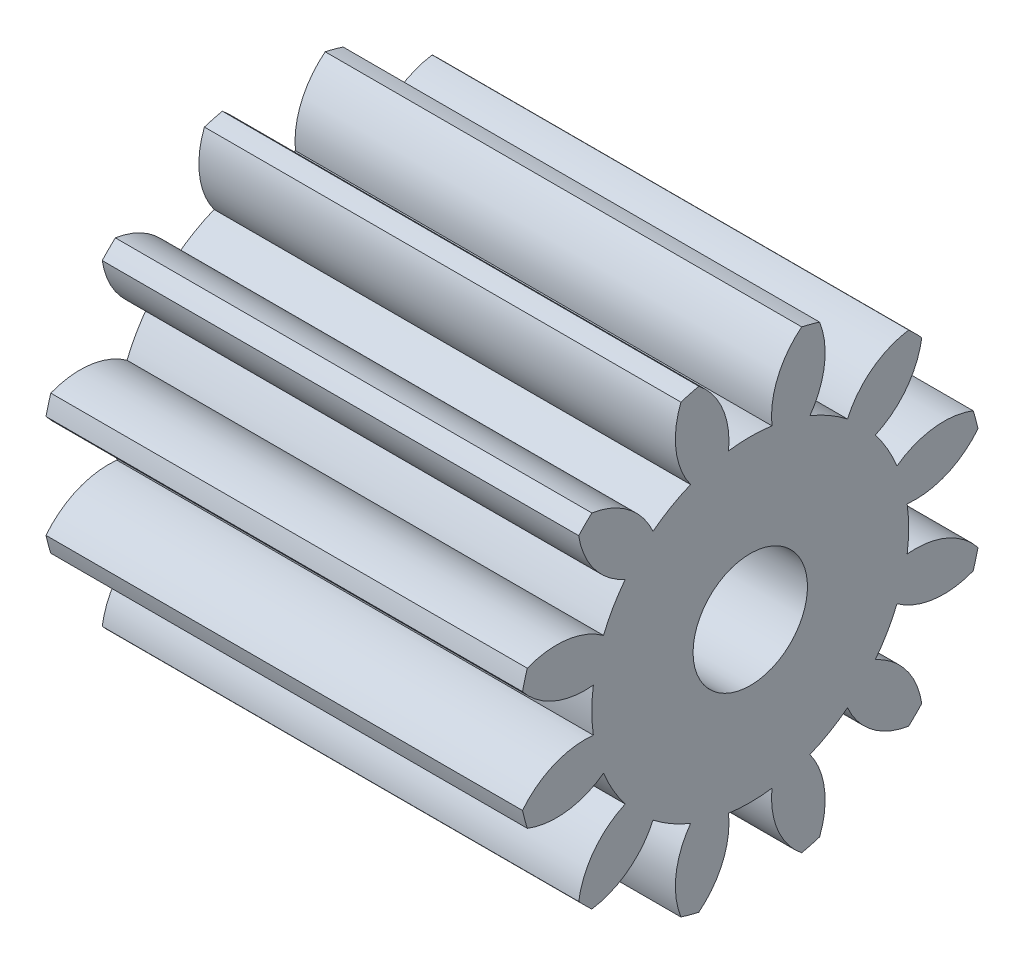
from build123d import *

# Parameters (mm, degrees)
BASPROSKE_W                                     = 10
BASPROSKE_H                                     = 4.9
TOOTHCUT_DEPTH                                  = 13.166347028
TEETHCUTS_COUNT                                 = 12
TEETHCUTS_ANGLE                                 = 330
BORSKE_R                                        = 0.5
BORE_DEPTH                                      = 50.0000508
SKETCH2_R                                       = 1
CUT_EXTRUDE1_DEPTH                              = 13.070224944
CSK_FOR_M2_FLAT_HEAD_MACHINE_SCREW1_D           = 2.4
CSK_FOR_M2_FLAT_HEAD_MACHINE_SCREW1_CSINK_D     = 4.4
CSK_FOR_M2_FLAT_HEAD_MACHINE_SCREW1_CSINK_ANGLE = 90


with BuildPart() as part:
    # BasProSke → Base-Revolve (revolve)
    with BuildSketch(Plane(origin=(0, 0, 0), x_dir=(1, 0, 0), z_dir=(0, 1, 0)), mode=Mode.PRIVATE) as base_revolve_sk:
        with Locations((5, 2.45)):
            Rectangle(BASPROSKE_W, BASPROSKE_H)
    revolve(base_revolve_sk.sketch.rotate(Axis((-10, 0, 0), (1, 0, 0)), 180), axis=Axis((-10, 0, 0), (1, 0, 0)))

    # TooCutSke → ToothCut (cut, through all)
    with BuildSketch(Plane(origin=(0, 0, 0), x_dir=(0, 0, -1), z_dir=(1, 0, 0))):
        with BuildLine():
            ThreePointArc((0.45535744, 3.292662388), (0, 3.324), (-0.45535744, 3.292662388))
            ThreePointArc((-0.45535744, 3.292662388), (-0.583649315, 4.130986789), (-1.105088241, 4.799827615))
            ThreePointArc((-1.105088241, 4.799827615), (0, 4.9254), (1.105088241, 4.799827615))
            ThreePointArc((1.105088241, 4.799827615), (0.583649315, 4.130986789), (0.45535744, 3.292662388))
        make_face()
    toothcut = extrude(amount=TOOTHCUT_DEPTH, mode=Mode.SUBTRACT)

    # TeethCuts: ToothCut ×12 about axis
    teethcuts_axis = Axis((-10, 0, 0), (1, 0, 0))
    for i in range(1, TEETHCUTS_COUNT):
        add(toothcut.rotate(teethcuts_axis, i * TEETHCUTS_ANGLE / (TEETHCUTS_COUNT - 1)), mode=Mode.SUBTRACT)

    # BorSke → Bore (cut, symmetric)
    with BuildSketch(Plane(origin=(0, 0, 0), x_dir=(0, 0, -1), z_dir=(1, 0, 0))):
        with Locations(Location((0, 0, 0), (0, 0, 180))):
            Circle(BORSKE_R)
    extrude(amount=BORE_DEPTH, both=True, mode=Mode.SUBTRACT)

    # Sketch2 → Cut-Extrude1 (cut, through all)
    with BuildSketch(Plane.ZY):
        Circle(SKETCH2_R)
    extrude(amount=-CUT_EXTRUDE1_DEPTH, mode=Mode.SUBTRACT)

    # CSK for M2 Flat Head Machine Screw1 (through all)
    with Locations(Plane.ZY):
        with Locations((0, 0)):
            CounterSinkHole(CSK_FOR_M2_FLAT_HEAD_MACHINE_SCREW1_D / 2, CSK_FOR_M2_FLAT_HEAD_MACHINE_SCREW1_CSINK_D / 2, counter_sink_angle=CSK_FOR_M2_FLAT_HEAD_MACHINE_SCREW1_CSINK_ANGLE)


solid = part.part
